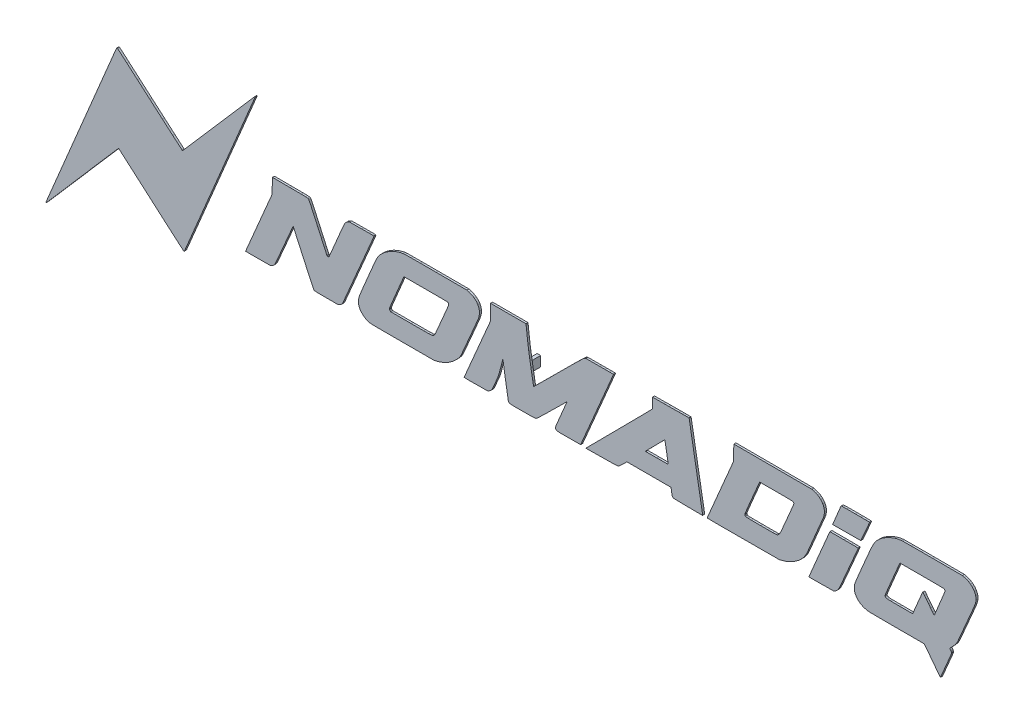
from build123d import *

# Parameters (mm, degrees)
Y_KSEKLIK_EKSTR_ZYON1_DEPTH   = 0.2
Y_KSEKLIK_EKSTR_ZYON1_2_DEPTH = 0.2
Y_KSEKLIK_EKSTR_ZYON1_3_DEPTH = 0.2
Y_KSEKLIK_EKSTR_ZYON1_4_DEPTH = 0.2
Y_KSEKLIK_EKSTR_ZYON1_5_DEPTH = 0.2
Y_KSEKLIK_EKSTR_ZYON1_6_DEPTH = 0.2
Y_KSEKLIK_EKSTR_ZYON1_7_DEPTH = 0.2
Y_KSEKLIK_EKSTR_ZYON1_8_DEPTH = 0.2
Y_KSEKLIK_EKSTR_ZYON1_9_DEPTH = 0.2
SKETCH4_W                     = 0.347706158
SKETCH4_H                     = 0.98459693
BOSS_EXTRUDE2_DEPTH           = 1
SCALE1_SCALE                  = 2.3


with BuildPart() as part:
    # Çizim1 → Yükseklik-Ekstrüzyon1 (new body)
    with BuildSketch(Plane.XY):
        with BuildLine():
            Line((-30.51702252, 5.640207004), (-31.881612062, 4.06777004))
            Line((-31.881612062, 4.06777004), (-33.036250842, 2.743929182))
            Line((-33.036250842, 2.743929182), (-34.080710724, 1.55031139))
            ThreePointArc((-34.080710724, 1.55031139), (-34.091671992, 1.542168784), (-34.10501822, 1.539282674))
            ThreePointArc((-34.10501822, 1.539282674), (-34.118726717, 1.541740246), (-34.130727781, 1.54880686))
            Line((-34.130727781, 1.54880686), (-35.069522655, 2.355004396))
            Line((-35.069522655, 2.355004396), (-36.109605746, 3.251459149))
            Line((-36.109605746, 3.251459149), (-37.338076284, 4.316207648))
            Line((-37.338076284, 4.316207648), (-38.566568336, 5.381941386))
            Line((-38.566568336, 5.381941386), (-39.606822395, 6.281527372))
            Line((-39.606822395, 6.281527372), (-40.544864829, 7.091037097))
            ThreePointArc((-40.544864829, 7.091037097), (-40.557629792, 7.100257414), (-40.571789719, 7.10714617))
            ThreePointArc((-40.571789719, 7.10714617), (-40.5829683, 7.1080489), (-40.592857954, 7.102760201))
            ThreePointArc((-40.592857954, 7.102760201), (-40.60694744, 7.08733319), (-40.619299402, 7.070482809))
            ThreePointArc((-40.619299402, 7.070482809), (-40.636141797, 7.042669784), (-40.651039165, 7.013768244))
            Line((-40.651039165, 7.013768244), (-40.690212238, 6.925912289))
            Line((-40.690212238, 6.925912289), (-42.278492498, 3.135697829))
            Line((-42.278492498, 3.135697829), (-44.770546021, -2.819218747))
            Line((-44.770546021, -2.819218747), (-47.603447582, -9.590605835))
            ThreePointArc((-47.603447582, -9.590605835), (-47.612762095, -9.614842221), (-47.620640209, -9.639582833))
            ThreePointArc((-47.620640209, -9.639582833), (-47.622682953, -9.648464643), (-47.623776393, -9.657512502))
            ThreePointArc((-47.623776393, -9.657512502), (-47.623612418, -9.665158958), (-47.622099978, -9.672656138))
            ThreePointArc((-47.622099978, -9.672656138), (-47.619722824, -9.678038864), (-47.616060206, -9.682644277))
            ThreePointArc((-47.616060206, -9.682644277), (-47.611784824, -9.685434425), (-47.606774081, -9.686412311))
            ThreePointArc((-47.606774081, -9.686412311), (-47.596603781, -9.684206995), (-47.588260373, -9.67798719))
            Line((-47.588260373, -9.67798719), (-46.540995922, -8.475870292))
            Line((-46.540995922, -8.475870292), (-45.384897882, -7.145566779))
            Line((-45.384897882, -7.145566779), (-44.016900278, -5.565418205))
            Line((-44.016900278, -5.565418205), (-42.649292697, -3.985259408))
            Line((-42.649292697, -3.985259408), (-41.494434005, -2.654966117))
            Line((-41.494434005, -2.654966117), (-40.447338079, -1.451149909))
            ThreePointArc((-40.447338079, -1.451149909), (-40.440685567, -1.446184753), (-40.432573306, -1.444424098))
            ThreePointArc((-40.432573306, -1.444424098), (-40.424232802, -1.445927767), (-40.416942521, -1.450249436))
            Line((-40.416942521, -1.450249436), (-39.470783162, -2.269237563))
            Line((-39.470783162, -2.269237563), (-38.425880059, -3.175657308))
            Line((-38.425880059, -3.175657308), (-37.188912139, -4.252299692))
            Line((-37.188912139, -4.252299692), (-35.600632388, -5.633848971))
            Line((-35.600632388, -5.633848971), (-34.660662613, -6.443124897))
            Line((-34.660662613, -6.443124897), (-33.971740802, -7.030480392))
            ThreePointArc((-33.971740802, -7.030480392), (-33.954050802, -7.036456708), (-33.937103258, -7.028618774))
            ThreePointArc((-33.937103258, -7.028618774), (-33.918071544, -7.004488567), (-33.903683781, -6.977332255))
            Line((-33.903683781, -6.977332255), (-30.415719601, 1.344084322))
            Line((-30.415719601, 1.344084322), (-26.926800707, 9.667966428))
            ThreePointArc((-26.926800707, 9.667966428), (-26.918578965, 9.694765841), (-26.915802041, 9.722660181))
            ThreePointArc((-26.915802041, 9.722660181), (-26.916283105, 9.726306898), (-26.91769339, 9.729704111))
            ThreePointArc((-26.91769339, 9.729704111), (-26.920050789, 9.732972259), (-26.923011854, 9.735705429))
            ThreePointArc((-26.923011854, 9.735705429), (-26.926812118, 9.738074074), (-26.930967674, 9.739742558))
            ThreePointArc((-26.930967674, 9.739742558), (-26.935605763, 9.740782255), (-26.94034612, 9.741131333))
            ThreePointArc((-26.94034612, 9.741131333), (-26.949504077, 9.739146935), (-26.957019216, 9.733549729))
            Line((-26.957019216, 9.733549729), (-28.001119252, 8.536484825))
            Line((-28.001119252, 8.536484825), (-29.153229053, 7.212664813))
            ThreePointArc((-29.153229053, 7.212664813), (-29.83537738, 6.426654115), (-30.51702252, 5.640207004))
        make_face()
    extrude(amount=Y_KSEKLIK_EKSTR_ZYON1_DEPTH)


with BuildPart() as body_2:
    # Çizim1 → Y_kseklik-Ekstr_zyon1 2 (new body)
    with BuildSketch(Plane.XY):
        with BuildLine():
            Line((34.002103981, 1.26593393), (33.401469652, -0.133194787))
            Line((33.401469652, -0.133194787), (33.068356265, -0.919046179))
            Line((33.068356265, -0.919046179), (32.780541835, -1.607236246))
            Line((32.780541835, -1.607236246), (32.536345399, -2.197879118))
            ThreePointArc((32.536345399, -2.197879118), (32.514730918, -2.255375588), (32.496752038, -2.314110499))
            ThreePointArc((32.496752038, -2.314110499), (32.475048302, -2.409792708), (32.46158888, -2.506978001))
            ThreePointArc((32.46158888, -2.506978001), (32.454335387, -2.617789021), (32.453635549, -2.728834983))
            ThreePointArc((32.453635549, -2.728834983), (32.45934273, -2.836087206), (32.471456413, -2.942805855))
            ThreePointArc((32.471456413, -2.942805855), (32.488615064, -3.027655366), (32.51524417, -3.110024958))
            ThreePointArc((32.51524417, -3.110024958), (32.598015349, -3.282399035), (32.706692791, -3.439730229))
            ThreePointArc((32.706692791, -3.439730229), (32.842536088, -3.584713762), (32.997270695, -3.709336501))
            ThreePointArc((32.997270695, -3.709336501), (33.178362317, -3.818649104), (33.37209352, -3.903570487))
            ThreePointArc((33.37209352, -3.903570487), (33.588460467, -3.96929215), (33.810587122, -4.011644735))
            ThreePointArc((33.810587122, -4.011644735), (33.899556978, -4.020972591), (33.988931573, -4.024823021))
            Line((33.988931573, -4.024823021), (34.653961876, -4.033038109))
            Line((34.653961876, -4.033038109), (35.528034198, -4.038897814))
            Line((35.528034198, -4.038897814), (36.700634893, -4.040997916))
            Line((36.700634893, -4.040997916), (39.381358713, -4.041881013))
            Line((39.381358713, -4.041881013), (40.168688525, -5.072515387))
            Line((40.168688525, -5.072515387), (40.471672307, -5.468355282))
            Line((40.471672307, -5.468355282), (40.729308349, -5.803224159))
            Line((40.729308349, -5.803224159), (40.960764599, -6.103025222))
            ThreePointArc((40.960764599, -6.103025222), (40.965728178, -6.108380079), (40.971569444, -6.112760857))
            ThreePointArc((40.971569444, -6.112760857), (40.980536493, -6.113867821), (40.987216734, -6.107784423))
            Line((40.987216734, -6.107784423), (41.525271591, -4.840033091))
            Line((41.525271591, -4.840033091), (42.037991789, -3.629832767))
            ThreePointArc((42.037991789, -3.629832767), (42.066806791, -3.554217315), (42.090091671, -3.476720121))
            ThreePointArc((42.090091671, -3.476720121), (42.091866692, -3.462041134), (42.089649173, -3.447422448))
            ThreePointArc((42.089649173, -3.447422448), (42.082221169, -3.425230658), (42.073172234, -3.403649008))
            ThreePointArc((42.073172234, -3.403649008), (42.059673501, -3.37676729), (42.044517758, -3.350783718))
            ThreePointArc((42.044517758, -3.350783718), (42.024882825, -3.320672342), (42.004149576, -3.291306409))
            Line((42.004149576, -3.291306409), (41.905031553, -3.15628061))
            Line((41.905031553, -3.15628061), (42.181877984, -2.866363537))
            ThreePointArc((42.181877984, -2.866363537), (42.242781131, -2.801216626), (42.302290033, -2.734793709))
            ThreePointArc((42.302290033, -2.734793709), (42.360432004, -2.667065558), (42.417129509, -2.598123669))
            ThreePointArc((42.417129509, -2.598123669), (42.467223313, -2.534442912), (42.515886055, -2.469662007))
            ThreePointArc((42.515886055, -2.469662007), (42.552003637, -2.417967566), (42.585675224, -2.364647597))
            ThreePointArc((42.585675224, -2.364647597), (42.664459092, -2.222753419), (42.733677151, -2.075955204))
            Line((42.733677151, -2.075955204), (43.510626934, -0.275958767))
            Line((43.510626934, -0.275958767), (44.264704846, 1.481742999))
            ThreePointArc((44.264704846, 1.481742999), (44.350931551, 1.69607884), (44.42787815, 1.913918501))
            ThreePointArc((44.42787815, 1.913918501), (44.474668475, 2.09316749), (44.498658632, 2.276862908))
            ThreePointArc((44.498658632, 2.276862908), (44.497009246, 2.450071361), (44.468931065, 2.620996797))
            ThreePointArc((44.468931065, 2.620996797), (44.4148335, 2.786765265), (44.33626524, 2.942434016))
            ThreePointArc((44.33626524, 2.942434016), (44.229301586, 3.097540689), (44.104447039, 3.238645774))
            ThreePointArc((44.104447039, 3.238645774), (44.029864114, 3.308427548), (43.950719161, 3.372989031))
            ThreePointArc((43.950719161, 3.372989031), (43.869333945, 3.430315276), (43.783968138, 3.481525928))
            ThreePointArc((43.783968138, 3.481525928), (43.689784399, 3.529322011), (43.592564606, 3.570593723))
            ThreePointArc((43.592564606, 3.570593723), (43.479323979, 3.611196818), (43.364327949, 3.646523356))
            Line((43.364327949, 3.646523356), (43.154477618, 3.705717052))
            Line((43.154477618, 3.705717052), (40.210910399, 3.709983164))
            Line((40.210910399, 3.709983164), (39.068321673, 3.709918807))
            Line((39.068321673, 3.709918807), (38.073061083, 3.706102713))
            Line((38.073061083, 3.706102713), (37.218259588, 3.700145881))
            ThreePointArc((37.218259588, 3.700145881), (37.142324383, 3.697538292), (37.066645419, 3.690781867))
            ThreePointArc((37.066645419, 3.690781867), (36.748045846, 3.637240098), (36.436400062, 3.552097196))
            ThreePointArc((36.436400062, 3.552097196), (36.105836544, 3.429413364), (35.785714306, 3.281611761))
            ThreePointArc((35.785714306, 3.281611761), (35.477485507, 3.109336623), (35.183436904, 2.913839475))
            ThreePointArc((35.183436904, 2.913839475), (34.930019667, 2.711059171), (34.69791904, 2.484190383))
            ThreePointArc((34.69791904, 2.484190383), (34.579233333, 2.345083525), (34.472303979, 2.19674901))
            ThreePointArc((34.472303979, 2.19674901), (34.366932693, 2.025944773), (34.272331054, 1.848948374))
            ThreePointArc((34.272331054, 1.848948374), (34.133445435, 1.559189511), (34.002103981, 1.26593393))
        make_face()
        with BuildLine():
            Line((41.408932632, 1.420979396), (40.91452838, 0.216535294))
            Line((40.91452838, 0.216535294), (40.420055007, -0.983846467))
            ThreePointArc((40.420055007, -0.983846467), (40.394632125, -1.032636029), (40.36097483, -1.076155344))
            ThreePointArc((40.36097483, -1.076155344), (40.353893848, -1.079121384), (40.347004716, -1.075733531))
            Line((40.347004716, -1.075733531), (40.188024724, -0.881888373))
            Line((40.188024724, -0.881888373), (40.008118257, -0.657479184))
            Line((40.008118257, -0.657479184), (39.797898801, -0.387093027))
            Line((39.797898801, -0.387093027), (39.587724356, -0.115332545))
            Line((39.587724356, -0.115332545), (39.407830653, 0.113502565))
            Line((39.407830653, 0.113502565), (39.246786084, 0.316042494))
            ThreePointArc((39.246786084, 0.316042494), (39.241550776, 0.320222793), (39.235019549, 0.321714909))
            ThreePointArc((39.235019549, 0.321714909), (39.228900127, 0.31988751), (39.224784801, 0.315003783))
            Line((39.224784801, 0.315003783), (39.077385422, -0.02410947))
            Line((39.077385422, -0.02410947), (38.914183191, -0.404157207))
            Line((38.914183191, -0.404157207), (38.723806616, -0.855559582))
            Line((38.723806616, -0.855559582), (38.230691459, -2.0328341))
            Line((38.230691459, -2.0328341), (36.946225763, -2.032592005))
            Line((36.946225763, -2.032592005), (36.026738721, -2.029967306))
            ThreePointArc((36.026738721, -2.029967306), (35.875481064, -2.025703145), (35.724571992, -2.014589469))
            ThreePointArc((35.724571992, -2.014589469), (35.649544634, -2.000929952), (35.577853042, -1.974929904))
            ThreePointArc((35.577853042, -1.974929904), (35.532477481, -1.941704962), (35.503641511, -1.893421163))
            ThreePointArc((35.503641511, -1.893421163), (35.495867211, -1.846409501), (35.504617437, -1.79956967))
            ThreePointArc((35.504617437, -1.79956967), (35.569300493, -1.630500251), (35.636155399, -1.462277817))
            Line((35.636155399, -1.462277817), (35.891488635, -0.845567436))
            Line((35.891488635, -0.845567436), (36.712056433, 1.091061579))
            Line((36.712056433, 1.091061579), (36.964632723, 1.686464948))
            Line((36.964632723, 1.686464948), (39.137080729, 1.686464948))
            Line((39.137080729, 1.686464948), (40.393285557, 1.685244626))
            Line((40.393285557, 1.685244626), (40.954397599, 1.679463593))
            Line((40.954397599, 1.679463593), (41.291963335, 1.67025887))
            ThreePointArc((41.291963335, 1.67025887), (41.332353577, 1.663192525), (41.369002218, 1.644802802))
            ThreePointArc((41.369002218, 1.644802802), (41.382729515, 1.633866704), (41.39500652, 1.621324294))
            ThreePointArc((41.39500652, 1.621324294), (41.405282108, 1.607693996), (41.413643556, 1.592812501))
            ThreePointArc((41.413643556, 1.592812501), (41.420269677, 1.576286022), (41.4247472, 1.559052862))
            ThreePointArc((41.4247472, 1.559052862), (41.427541535, 1.539642723), (41.428475816, 1.520054744))
            ThreePointArc((41.428475816, 1.520054744), (41.423543396, 1.469562516), (41.408932632, 1.420979396))
        make_face(mode=Mode.SUBTRACT)
    extrude(amount=Y_KSEKLIK_EKSTR_ZYON1_2_DEPTH)


with BuildPart() as body_3:
    # Çizim1 → Y_kseklik-Ekstr_zyon1 3 (new body)
    with BuildSketch(Plane.XY):
        with BuildLine():
            Line((-25.211224785, 2.950808873), (-25.227873842, 2.206347809))
            Line((-25.227873842, 2.206347809), (-26.529654081, -0.856672391))
            Line((-26.529654081, -0.856672391), (-27.029758258, -2.03354637))
            Line((-27.029758258, -2.03354637), (-27.453071642, -3.030058673))
            Line((-27.453071642, -3.030058673), (-27.833703249, -3.926302131))
            Line((-27.833703249, -3.926302131), (-27.845171441, -3.954171772))
            ThreePointArc((-27.845171441, -3.954171772), (-27.843842865, -3.967312442), (-27.83231739, -3.973762693))
            Line((-27.83231739, -3.973762693), (-27.614904594, -3.980356068))
            Line((-27.614904594, -3.980356068), (-27.278222587, -3.983689979))
            Line((-27.278222587, -3.983689979), (-26.631394189, -3.980931963))
            Line((-26.631394189, -3.980931963), (-25.403879775, -3.973212512))
            Line((-25.403879775, -3.973212512), (-25.250700632, -3.897992354))
            ThreePointArc((-25.250700632, -3.897992354), (-25.217687603, -3.880680333), (-25.185638296, -3.861643313))
            ThreePointArc((-25.185638296, -3.861643313), (-25.150757396, -3.838720203), (-25.11676827, -3.814494484))
            ThreePointArc((-25.11676827, -3.814494484), (-25.085085464, -3.790041552), (-25.054363066, -3.764392375))
            ThreePointArc((-25.054363066, -3.764392375), (-25.031252928, -3.742732785), (-25.009863314, -3.719372548))
            ThreePointArc((-25.009863314, -3.719372548), (-24.972694312, -3.668803102), (-24.942874437, -3.613580113))
            Line((-24.942874437, -3.613580113), (-24.735598075, -3.156531823))
            Line((-24.735598075, -3.156531823), (-24.453957617, -2.517394056))
            Line((-24.453957617, -2.517394056), (-24.039131152, -1.554161376))
            Line((-24.039131152, -1.554161376), (-23.699391394, -0.763531183))
            Line((-23.699391394, -0.763531183), (-23.410821404, -0.09780246))
            Line((-23.410821404, -0.09780246), (-23.149294716, 0.502140639))
            ThreePointArc((-23.149294716, 0.502140639), (-23.145665955, 0.506536134), (-23.140260373, 0.508343886))
            ThreePointArc((-23.140260373, 0.508343886), (-23.134825907, 0.506946553), (-23.131091279, 0.502758652))
            Line((-23.131091279, 0.502758652), (-22.835810828, -0.136341435))
            Line((-22.835810828, -0.136341435), (-22.51000193, -0.845183811))
            Line((-22.51000193, -0.845183811), (-22.126024477, -1.687301169))
            Line((-22.126024477, -1.687301169), (-21.620113231, -2.795615239))
            Line((-21.620113231, -2.795615239), (-21.322786771, -3.432082174))
            Line((-21.322786771, -3.432082174), (-21.11385138, -3.866353122))
            ThreePointArc((-21.11385138, -3.866353122), (-21.090737802, -3.90108777), (-21.059220458, -3.928426211))
            ThreePointArc((-21.059220458, -3.928426211), (-21.023863025, -3.945901297), (-20.985349445, -3.954400168))
            ThreePointArc((-20.985349445, -3.954400168), (-20.899319004, -3.961416502), (-20.813117741, -3.965867101))
            ThreePointArc((-20.813117741, -3.965867101), (-20.663197966, -3.970135482), (-20.513228263, -3.971937272))
            Line((-20.513228263, -3.971937272), (-19.839021238, -3.973214245))
            Line((-19.839021238, -3.973214245), (-18.687190754, -3.973214245))
            Line((-18.687190754, -3.973214245), (-18.517445616, -3.881186024))
            ThreePointArc((-18.517445616, -3.881186024), (-18.482303458, -3.861238906), (-18.44796421, -3.839939262))
            ThreePointArc((-18.44796421, -3.839939262), (-18.41333894, -3.816639004), (-18.379558411, -3.792130084))
            ThreePointArc((-18.379558411, -3.792130084), (-18.350067102, -3.769084074), (-18.32142443, -3.744991477))
            ThreePointArc((-18.32142443, -3.744991477), (-18.302919485, -3.727044384), (-18.286407888, -3.707247961))
            ThreePointArc((-18.286407888, -3.707247961), (-18.252048136, -3.65510512), (-18.224151108, -3.599237201))
            Line((-18.224151108, -3.599237201), (-16.713731049, -0.059918911))
            Line((-16.713731049, -0.059918911), (-15.222493404, 3.436166873))
            ThreePointArc((-15.222493404, 3.436166873), (-15.181801611, 3.540930402), (-15.148018691, 3.648121508))
            ThreePointArc((-15.148018691, 3.648121508), (-15.151158888, 3.667669436), (-15.168063421, 3.677975702))
            ThreePointArc((-15.168063421, 3.677975702), (-15.238167294, 3.684653858), (-15.308486134, 3.688450118))
            ThreePointArc((-15.308486134, 3.688450118), (-15.449595441, 3.691794732), (-15.590743095, 3.692397122))
            Line((-15.590743095, 3.692397122), (-16.348890724, 3.688267249))
            Line((-16.348890724, 3.688267249), (-17.563283304, 3.680066712))
            Line((-17.563283304, 3.680066712), (-17.695506951, 3.614506057))
            ThreePointArc((-17.695506951, 3.614506057), (-17.802334593, 3.550033382), (-17.89708974, 3.468852518))
            ThreePointArc((-17.89708974, 3.468852518), (-17.981687679, 3.369816632), (-18.051028752, 3.259559055))
            ThreePointArc((-18.051028752, 3.259559055), (-18.153011486, 3.057283908), (-18.246144045, 2.850784419))
            Line((-18.246144045, 2.850784419), (-18.805874805, 1.52590103))
            Line((-18.805874805, 1.52590103), (-19.098449411, 0.831007738))
            Line((-19.098449411, 0.831007738), (-19.349111607, 0.240390047))
            Line((-19.349111607, 0.240390047), (-19.573236314, -0.284773761))
            ThreePointArc((-19.573236314, -0.284773761), (-19.580906662, -0.299875069), (-19.590508016, -0.313828482))
            ThreePointArc((-19.590508016, -0.313828482), (-19.597563454, -0.321059745), (-19.605960459, -0.326677634))
            ThreePointArc((-19.605960459, -0.326677634), (-19.618425121, -0.33259943), (-19.631343535, -0.337452268))
            ThreePointArc((-19.631343535, -0.337452268), (-19.646310856, -0.34172327), (-19.661567254, -0.344806209))
            ThreePointArc((-19.661567254, -0.344806209), (-19.676924497, -0.346659137), (-19.692380729, -0.347278109))
            ThreePointArc((-19.692380729, -0.347278109), (-19.707631947, -0.346658834), (-19.722782748, -0.344805085))
            ThreePointArc((-19.722782748, -0.344805085), (-19.737441352, -0.341752399), (-19.751783682, -0.337452268))
            ThreePointArc((-19.751783682, -0.337452268), (-19.763833164, -0.332620652), (-19.775375089, -0.326677715))
            ThreePointArc((-19.775375089, -0.326677715), (-19.782823658, -0.321072837), (-19.788690101, -0.313828482))
            ThreePointArc((-19.788690101, -0.313828482), (-19.796630266, -0.300140237), (-19.803663618, -0.285964687))
            Line((-19.803663618, -0.285964687), (-20.059785204, 0.275398962))
            Line((-20.059785204, 0.275398962), (-20.346168765, 0.904480674))
            Line((-20.346168765, 0.904480674), (-20.682237627, 1.645080393))
            Line((-20.682237627, 1.645080393), (-21.125146527, 2.61767739))
            Line((-21.125146527, 2.61767739), (-21.387348416, 3.17841972))
            Line((-21.387348416, 3.17841972), (-21.570183946, 3.555457177))
            ThreePointArc((-21.570183946, 3.555457177), (-21.595062868, 3.593817601), (-21.628220762, 3.62529834))
            ThreePointArc((-21.628220762, 3.62529834), (-21.66998415, 3.648475335), (-21.716412578, 3.659689374))
            ThreePointArc((-21.716412578, 3.659689374), (-21.819651831, 3.668505866), (-21.923130902, 3.673812074))
            ThreePointArc((-21.923130902, 3.673812074), (-22.124276987, 3.679245381), (-22.325480701, 3.681762169))
            Line((-22.325480701, 3.681762169), (-23.448059115, 3.687666328))
            Line((-23.448059115, 3.687666328), (-25.194575701, 3.69526991))
            Line((-25.194575701, 3.69526991), (-25.211224785, 2.950808873))
        make_face()
    extrude(amount=Y_KSEKLIK_EKSTR_ZYON1_3_DEPTH)


with BuildPart() as body_4:
    # Çizim1 → Y_kseklik-Ekstr_zyon1 4 (new body)
    with BuildSketch(Plane.XY):
        with BuildLine():
            Line((-3.581342788, 2.937687788), (-3.581342788, 2.181933006))
            Line((-3.581342788, 2.181933006), (-4.877979733, -0.855499969))
            Line((-4.877979733, -0.855499969), (-5.376389886, -2.023485284))
            Line((-5.376389886, -2.023485284), (-5.798977842, -3.01476082))
            Line((-5.798977842, -3.01476082), (-6.177187776, -3.902529936))
            Line((-6.177187776, -3.902529936), (-6.192483113, -3.940843862))
            ThreePointArc((-6.192483113, -3.940843862), (-6.19070565, -3.959778104), (-6.174757915, -3.97013835))
            ThreePointArc((-6.174757915, -3.97013835), (-6.108607024, -3.976973725), (-6.042214703, -3.980810708))
            ThreePointArc((-6.042214703, -3.980810708), (-5.907118341, -3.984188986), (-5.771981293, -3.984835491))
            Line((-5.771981293, -3.984835491), (-5.049714422, -3.980989702))
            Line((-5.049714422, -3.980989702), (-3.889079328, -3.97321831))
            Line((-3.889079328, -3.97321831), (-3.755280818, -3.902422923))
            ThreePointArc((-3.755280818, -3.902422923), (-3.699406401, -3.871110537), (-3.645107405, -3.837139446))
            ThreePointArc((-3.645107405, -3.837139446), (-3.599819747, -3.804816928), (-3.557023912, -3.769260866))
            ThreePointArc((-3.557023912, -3.769260866), (-3.521239651, -3.734453546), (-3.488472326, -3.696792355))
            ThreePointArc((-3.488472326, -3.696792355), (-3.460868421, -3.65854243), (-3.437163193, -3.617761375))
            Line((-3.437163193, -3.617761375), (-3.409467918, -3.559967109))
            Line((-3.409467918, -3.559967109), (-3.318231303, -3.353000723))
            Line((-3.318231303, -3.353000723), (-3.210920349, -3.107231993))
            Line((-3.210920349, -3.107231993), (-3.091713476, -2.831363443))
            Line((-3.091713476, -2.831363443), (-2.901984085, -2.380888318))
            ThreePointArc((-2.901984085, -2.380888318), (-2.849132695, -2.246303299), (-2.800821012, -2.110022788))
            ThreePointArc((-2.800821012, -2.110022788), (-2.75541317, -1.967498293), (-2.714442326, -1.823635533))
            Line((-2.714442326, -1.823635533), (-2.576637461, -1.297248111))
            Line((-2.576637461, -1.297248111), (-2.364693476, -0.46769735))
            Line((-2.364693476, -0.46769735), (-2.342424293, -0.614875711))
            Line((-2.342424293, -0.614875711), (-2.175886465, -1.688377522))
            Line((-2.175886465, -1.688377522), (-2.001020215, -2.762609366))
            Line((-2.001020215, -2.762609366), (-1.827657004, -3.799629649))
            ThreePointArc((-1.827657004, -3.799629649), (-1.817395198, -3.837107712), (-1.799818726, -3.871762834))
            ThreePointArc((-1.799818726, -3.871762834), (-1.760431233, -3.913931089), (-1.708668946, -3.939430146))
            ThreePointArc((-1.708668946, -3.939430146), (-1.619855191, -3.95992499), (-1.52943784, -3.971441252))
            ThreePointArc((-1.52943784, -3.971441252), (-1.361958109, -3.981086279), (-1.194232166, -3.984325861))
            Line((-1.194232166, -3.984325861), (-0.370178516, -3.981533674))
            Line((-0.370178516, -3.981533674), (0.412079155, -3.974955416))
            ThreePointArc((0.412079155, -3.974955416), (0.547774653, -3.97215356), (0.683377872, -3.966418964))
            ThreePointArc((0.683377872, -3.966418964), (0.758299272, -3.959984356), (0.832642232, -3.948681938))
            ThreePointArc((0.832642232, -3.948681938), (0.888170338, -3.934183881), (0.941046882, -3.911876136))
            ThreePointArc((0.941046882, -3.911876136), (0.992500522, -3.880863438), (1.03902599, -3.842854948))
            Line((1.03902599, -3.842854948), (1.389463403, -3.51226382))
            Line((1.389463403, -3.51226382), (1.858226268, -3.059906204))
            Line((1.858226268, -3.059906204), (2.519872102, -2.409282638))
            Line((2.519872102, -2.409282638), (3.079518863, -1.857025568))
            Line((3.079518863, -1.857025568), (3.55159268, -1.39300024))
            Line((3.55159268, -1.39300024), (3.979388074, -0.973548682))
            ThreePointArc((3.979388074, -0.973548682), (3.981752203, -0.972565078), (3.984141133, -0.973486813))
            ThreePointArc((3.984141133, -0.973486813), (3.985534003, -0.975937947), (3.985273983, -0.978745176))
            Line((3.985273983, -0.978745176), (3.822937263, -1.366031839))
            Line((3.822937263, -1.366031839), (3.64253716, -1.794380169))
            Line((3.64253716, -1.794380169), (3.427125626, -2.30214522))
            Line((3.427125626, -2.30214522), (3.210345334, -2.815298578))
            Line((3.210345334, -2.815298578), (3.02532177, -3.261124231))
            Line((3.02532177, -3.261124231), (2.867303964, -3.647433203))
            ThreePointArc((2.867303964, -3.647433203), (2.856866474, -3.677566958), (2.849710985, -3.708644014))
            ThreePointArc((2.849710985, -3.708644014), (2.845973777, -3.745525407), (2.847549657, -3.782562152))
            ThreePointArc((2.847549657, -3.782562152), (2.854536895, -3.815872144), (2.867531368, -3.847328792))
            ThreePointArc((2.867531368, -3.847328792), (2.886447157, -3.876601018), (2.910271107, -3.902038976))
            ThreePointArc((2.910271107, -3.902038976), (2.941141306, -3.926286718), (2.97480815, -3.946472498))
            ThreePointArc((2.97480815, -3.946472498), (3.013686618, -3.961838711), (3.054855409, -3.969104141))
            ThreePointArc((3.054855409, -3.969104141), (3.149011305, -3.974975016), (3.243277696, -3.978669236))
            ThreePointArc((3.243277696, -3.978669236), (3.400427041, -3.981853612), (3.557606227, -3.982725472))
            Line((3.557606227, -3.982725472), (4.195740639, -3.980199115))
            Line((4.195740639, -3.980199115), (5.337959412, -3.973221282))
            Line((5.337959412, -3.973221282), (6.966141947, -0.151542952))
            Line((6.966141947, -0.151542952), (7.590452564, 1.31477638))
            Line((7.590452564, 1.31477638), (8.116045838, 2.551335091))
            Line((8.116045838, 2.551335091), (8.592238508, 3.672881405))
            ThreePointArc((8.592238508, 3.672881405), (8.593797679, 3.677901592), (8.594324454, 3.68313187))
            ThreePointArc((8.594324454, 3.68313187), (8.592776351, 3.686879381), (8.58903474, 3.688441694))
            Line((8.58903474, 3.688441694), (8.19146549, 3.68994968))
            Line((8.19146549, 3.68994968), (7.748767457, 3.690239006))
            Line((7.748767457, 3.690239006), (7.222889727, 3.688090951))
            Line((7.222889727, 3.688090951), (5.851455, 3.680053487))
            Line((5.851455, 3.680053487), (5.71765649, 3.615824288))
            ThreePointArc((5.71765649, 3.615824288), (5.650411941, 3.576670019), (5.590236811, 3.527336057))
            Line((5.590236811, 3.527336057), (5.118193952, 3.072857184))
            Line((5.118193952, 3.072857184), (4.407638634, 2.374674269))
            Line((4.407638634, 2.374674269), (3.128651934, 1.100755241))
            Line((3.128651934, 1.100755241), (2.187151745, 0.162855195))
            Line((2.187151745, 0.162855195), (1.394665044, -0.622263838))
            Line((1.394665044, -0.622263838), (0.681246947, -1.326491717))
            ThreePointArc((0.681246947, -1.326491717), (0.676262866, -1.327457611), (0.673449277, -1.32323177))
            ThreePointArc((0.673449277, -1.32323177), (0.67299094, -1.312469272), (0.67161927, -1.301784706))
            Line((0.67161927, -1.301784706), (0.598422887, -0.875986487))
            Line((0.598422887, -0.875986487), (0.515960564, -0.399306737))
            Line((0.515960564, -0.399306737), (0.418040258, 0.161592244))
            Line((0.418040258, 0.161592244), (0.291188032, 0.903058978))
            Line((0.291188032, 0.903058978), (0.196068557, 1.500503631))
            Line((0.196068557, 1.500503631), (0.121258385, 2.026138864))
            Line((0.121258385, 2.026138864), (0.057410592, 2.542769672))
            Line((0.057410592, 2.542769672), (0.015963453, 2.90471522))
            Line((0.015963453, 2.90471522), (-0.021497427, 3.228194365))
            Line((-0.021497427, 3.228194365), (-0.053395607, 3.500805617))
            Line((-0.053395607, 3.500805617), (-0.063455837, 3.579708124))
            Line((-0.063455837, 3.579708124), (-0.079101673, 3.693436857))
            Line((-0.079101673, 3.693436857), (-1.830222506, 3.693436857))
            Line((-1.830222506, 3.693436857), (-3.581342788, 3.693436857))
            Line((-3.581342788, 3.693436857), (-3.581342788, 2.937687788))
        make_face()
    extrude(amount=Y_KSEKLIK_EKSTR_ZYON1_4_DEPTH)

    # Sketch4 → Boss-Extrude2 (add)
    with BuildSketch(Plane(origin=(0, 0, 0), x_dir=(-1, 0, 0), z_dir=(0, 0, -1))):
        Rectangle(SKETCH4_W, SKETCH4_H)
    extrude(amount=BOSS_EXTRUDE2_DEPTH)


with BuildPart() as body_5:
    # Çizim1 → Y_kseklik-Ekstr_zyon1 5 (new body)
    with BuildSketch(Plane.XY):
        with BuildLine():
            Line((13.591695964, 3.673380528), (12.447718704, 3.666108284))
            Line((12.447718704, 3.666108284), (12.447718704, 3.155410932))
            Line((12.447718704, 3.155410932), (12.447718704, 2.64471358))
            Line((12.447718704, 2.64471358), (11.972733993, 2.155333862))
            Line((11.972733993, 2.155333862), (11.660281424, 1.836288425))
            Line((11.660281424, 1.836288425), (10.807976166, 0.974355882))
            Line((10.807976166, 0.974355882), (9.790523593, -0.052936313))
            Line((9.790523593, -0.052936313), (8.674600723, -1.17780265))
            Line((8.674600723, -1.17780265), (5.851452163, -4.021559472))
            Line((5.851452163, -4.021559472), (7.400482951, -4.003709787))
            Line((7.400482951, -4.003709787), (8.366956846, -3.991388577))
            ThreePointArc((8.366956846, -3.991388577), (8.555267482, -3.987403622), (8.743501416, -3.980713195))
            ThreePointArc((8.743501416, -3.980713195), (8.847707326, -3.974437186), (8.951630966, -3.964530774))
            ThreePointArc((8.951630966, -3.964530774), (9.012300957, -3.95295854), (9.070519291, -3.932333554))
            ThreePointArc((9.070519291, -3.932333554), (9.108676622, -3.912748433), (9.144323299, -3.888897366))
            ThreePointArc((9.144323299, -3.888897366), (9.198666305, -3.846504519), (9.251707467, -3.802493714))
            ThreePointArc((9.251707467, -3.802493714), (9.320097967, -3.74248067), (9.386959109, -3.680768325))
            Line((9.386959109, -3.680768325), (9.554919536, -3.517924085))
            Line((9.554919536, -3.517924085), (9.918314229, -3.157041112))
            Line((9.918314229, -3.157041112), (12.103479168, -3.157041112))
            Line((12.103479168, -3.157041112), (14.288644106, -3.157041112))
            Line((14.288644106, -3.157041112), (14.319315836, -3.3376691))
            Line((14.319315836, -3.3376691), (14.333123494, -3.419007141))
            Line((14.333123494, -3.419007141), (14.34933099, -3.514526888))
            Line((14.34933099, -3.514526888), (14.365325959, -3.608828211))
            Line((14.365325959, -3.608828211), (14.378424191, -3.686090321))
            ThreePointArc((14.378424191, -3.686090321), (14.38496437, -3.720539801), (14.39285899, -3.754704338))
            ThreePointArc((14.39285899, -3.754704338), (14.402111767, -3.788606903), (14.412686511, -3.822120671))
            ThreePointArc((14.412686511, -3.822120671), (14.423089822, -3.851055711), (14.434635942, -3.879554002))
            ThreePointArc((14.434635942, -3.879554002), (14.443710759, -3.897257414), (14.455129511, -3.913547754))
            Line((14.455129511, -3.913547754), (14.503398208, -3.973212023))
            Line((14.503398208, -3.973212023), (15.951798842, -3.996773806))
            Line((15.951798842, -3.996773806), (16.508385069, -4.004548196))
            Line((16.508385069, -4.004548196), (16.979872152, -4.008273949))
            Line((16.979872152, -4.008273949), (17.400693781, -4.009846857))
            ThreePointArc((17.400693781, -4.009846857), (17.409896429, -4.008040294), (17.417698554, -4.002836519))
            ThreePointArc((17.417698554, -4.002836519), (17.425884203, -3.989352189), (17.426924001, -3.973612086))
            Line((17.426924001, -3.973612086), (16.759811494, -0.174981033))
            Line((16.759811494, -0.174981033), (16.096046881, 3.603415005))
            ThreePointArc((16.096046881, 3.603415005), (16.086078489, 3.639653057), (16.069478939, 3.673372787))
            ThreePointArc((16.069478939, 3.673372787), (16.063459353, 3.679206411), (16.055383791, 3.681454052))
            Line((16.055383791, 3.681454052), (15.866662903, 3.685668583))
            Line((15.866662903, 3.685668583), (15.650595757, 3.688053729))
            Line((15.650595757, 3.688053729), (15.396396571, 3.687047671))
            Line((15.396396571, 3.687047671), (15.064684295, 3.684093534))
            Line((15.064684295, 3.684093534), (14.593717393, 3.680395048))
            Line((14.593717393, 3.680395048), (14.078109662, 3.67663341))
            ThreePointArc((14.078109662, 3.67663341), (13.834903081, 3.67496684), (13.591695964, 3.673380528))
        make_face()
        with BuildLine():
            Line((13.853552226, -0.354999481), (13.915636046, -0.717684158))
            Line((13.915636046, -0.717684158), (13.966243406, -1.026353628))
            Line((13.966243406, -1.026353628), (14.009776357, -1.300406533))
            ThreePointArc((14.009776357, -1.300406533), (14.009759396, -1.309078736), (14.007034075, -1.317311599))
            ThreePointArc((14.007034075, -1.317311599), (13.995308672, -1.329872078), (13.978770455, -1.334534486))
            Line((13.978770455, -1.334534486), (12.888343957, -1.337035454))
            Line((12.888343957, -1.337035454), (11.795917416, -1.338965257))
            ThreePointArc((11.795917416, -1.338965257), (11.783762948, -1.333946919), (11.778726154, -1.321800086))
            ThreePointArc((11.778726154, -1.321800086), (11.78239682, -1.303189638), (11.792858996, -1.287366699))
            Line((11.792858996, -1.287366699), (12.722639693, -0.345511936))
            Line((12.722639693, -0.345511936), (13.656683907, 0.60013871))
            ThreePointArc((13.656683907, 0.60013871), (13.666680675, 0.604332847), (13.676702679, 0.600199374))
            ThreePointArc((13.676702679, 0.600199374), (13.68091864, 0.594476389), (13.683248558, 0.587760858))
            Line((13.683248558, 0.587760858), (13.733996809, 0.314265162))
            Line((13.733996809, 0.314265162), (13.78978383, 0.007183104))
            ThreePointArc((13.78978383, 0.007183104), (13.821854914, -0.173875284), (13.853552226, -0.354999481))
        make_face(mode=Mode.SUBTRACT)
    extrude(amount=Y_KSEKLIK_EKSTR_ZYON1_5_DEPTH)


with BuildPart() as body_6:
    # Çizim1 → Y_kseklik-Ekstr_zyon1 6 (new body)
    with BuildSketch(Plane.XY):
        with BuildLine():
            Line((31.112719083, 3.61013533), (31.010052357, 3.365928946))
            Line((31.010052357, 3.365928946), (30.89190953, 3.083300172))
            Line((30.89190953, 3.083300172), (30.756421065, 2.756853028))
            Line((30.756421065, 2.756853028), (30.618808468, 2.424701518))
            Line((30.618808468, 2.424701518), (30.493966831, 2.124125146))
            Line((30.493966831, 2.124125146), (30.388978057, 1.8719529))
            Line((30.388978057, 1.8719529), (30.352849088, 1.786575589))
            Line((30.352849088, 1.786575589), (30.29813762, 1.659228763))
            Line((30.29813762, 1.659228763), (31.693687253, 1.66615693))
            Line((31.693687253, 1.66615693), (33.089236887, 1.673085097))
            Line((33.089236887, 1.673085097), (33.525372371, 2.663194071))
            Line((33.525372371, 2.663194071), (33.69261818, 3.044235877))
            Line((33.69261818, 3.044235877), (33.833541594, 3.368354017))
            Line((33.833541594, 3.368354017), (33.958614301, 3.657906703))
            ThreePointArc((33.958614301, 3.657906703), (33.961055271, 3.665476821), (33.962013505, 3.673372821))
            ThreePointArc((33.962013505, 3.673372821), (33.95977608, 3.679139125), (33.954103599, 3.681604746))
            Line((33.954103599, 3.681604746), (33.549962424, 3.687547091))
            Line((33.549962424, 3.687547091), (33.096884008, 3.692000414))
            Line((33.096884008, 3.692000414), (32.558576316, 3.693442575))
            Line((32.558576316, 3.693442575), (31.697002862, 3.692336462))
            ThreePointArc((31.697002862, 3.692336462), (31.529332623, 3.690639931), (31.361707114, 3.686411918))
            ThreePointArc((31.361707114, 3.686411918), (31.267942718, 3.682232818), (31.174302699, 3.675847407))
            ThreePointArc((31.174302699, 3.675847407), (31.148374476, 3.666927147), (31.129957551, 3.646613096))
            ThreePointArc((31.129957551, 3.646613096), (31.120941637, 3.628561674), (31.112719083, 3.61013533))
        make_face()
    extrude(amount=Y_KSEKLIK_EKSTR_ZYON1_6_DEPTH)


with BuildPart() as body_7:
    # Çizim1 → Y_kseklik-Ekstr_zyon1 7 (new body)
    with BuildSketch(Plane.XY):
        with BuildLine():
            Line((-14.928138507, 1.758356615), (-15.172333555, 1.188149123))
            Line((-15.172333555, 1.188149123), (-15.455645504, 0.523192953))
            Line((-15.455645504, 0.523192953), (-15.778903293, -0.240233595))
            Line((-15.778903293, -0.240233595), (-16.38384481, -1.682932245))
            ThreePointArc((-16.38384481, -1.682932245), (-16.492546721, -1.956725141), (-16.592156754, -2.233955184))
            ThreePointArc((-16.592156754, -2.233955184), (-16.639880175, -2.398482509), (-16.672244795, -2.566706458))
            ThreePointArc((-16.672244795, -2.566706458), (-16.682347813, -2.712050518), (-16.670749998, -2.857282944))
            ThreePointArc((-16.670749998, -2.857282944), (-16.651609527, -2.957214032), (-16.625523774, -3.055560936))
            ThreePointArc((-16.625523774, -3.055560936), (-16.594736036, -3.142100568), (-16.555875522, -3.225328286))
            ThreePointArc((-16.555875522, -3.225328286), (-16.508129664, -3.30679487), (-16.453136516, -3.383555701))
            ThreePointArc((-16.453136516, -3.383555701), (-16.382832864, -3.467556124), (-16.30770931, -3.54727517))
            ThreePointArc((-16.30770931, -3.54727517), (-16.230933159, -3.619602234), (-16.149948825, -3.687184178))
            ThreePointArc((-16.149948825, -3.687184178), (-16.070215782, -3.745140417), (-15.986434442, -3.797072787))
            ThreePointArc((-15.986434442, -3.797072787), (-15.897666117, -3.843510204), (-15.805780202, -3.883425462))
            ThreePointArc((-15.805780202, -3.883425462), (-15.702052685, -3.920894313), (-15.596448981, -3.952693218))
            ThreePointArc((-15.596448981, -3.952693218), (-15.504170827, -3.972241493), (-15.410274322, -3.981232547))
            ThreePointArc((-15.410274322, -3.981232547), (-15.192441959, -3.988355926), (-14.974538656, -3.992809116))
            Line((-14.974538656, -3.992809116), (-14.201239142, -3.998810487))
            Line((-14.201239142, -3.998810487), (-12.291625786, -3.999971725))
            Line((-12.291625786, -3.999971725), (-9.160740653, -3.999971725))
            Line((-9.160740653, -3.999971725), (-8.872671765, -3.924864653))
            ThreePointArc((-8.872671765, -3.924864653), (-8.606556175, -3.846491173), (-8.345876713, -3.751590552))
            ThreePointArc((-8.345876713, -3.751590552), (-8.098720424, -3.64284155), (-7.859526301, -3.517546907))
            ThreePointArc((-7.859526301, -3.517546907), (-7.631219554, -3.377311845), (-7.413061305, -3.221758568))
            ThreePointArc((-7.413061305, -3.221758568), (-7.20326046, -3.0497456), (-7.005274729, -2.864255693))
            ThreePointArc((-7.005274729, -2.864255693), (-6.943134452, -2.80073685), (-6.882342531, -2.735926358))
            ThreePointArc((-6.882342531, -2.735926358), (-6.823660322, -2.670618883), (-6.766414658, -2.604048606))
            ThreePointArc((-6.766414658, -2.604048606), (-6.716231693, -2.542970211), (-6.667473336, -2.480748649))
            ThreePointArc((-6.667473336, -2.480748649), (-6.631508611, -2.431272847), (-6.598016442, -2.380090906))
            ThreePointArc((-6.598016442, -2.380090906), (-6.518184204, -2.239941857), (-6.448961621, -2.094260093))
            Line((-6.448961621, -2.094260093), (-5.65771842, -0.256093023))
            Line((-5.65771842, -0.256093023), (-4.881822359, 1.557288458))
            ThreePointArc((-4.881822359, 1.557288458), (-4.808140235, 1.744589786), (-4.745168429, 1.935758283))
            ThreePointArc((-4.745168429, 1.935758283), (-4.693256619, 2.198883786), (-4.692043383, 2.467078481))
            ThreePointArc((-4.692043383, 2.467078481), (-4.742993679, 2.71676195), (-4.847523627, 2.949165171))
            ThreePointArc((-4.847523627, 2.949165171), (-5.004851933, 3.161040399), (-5.203017731, 3.335320703))
            ThreePointArc((-5.203017731, 3.335320703), (-5.452496019, 3.483692207), (-5.72231033, 3.590714431))
            Line((-5.72231033, 3.590714431), (-5.922816492, 3.652333767))
            Line((-5.922816492, 3.652333767), (-8.98680237, 3.657145349))
            Line((-8.98680237, 3.657145349), (-10.545140075, 3.658095211))
            Line((-10.545140075, 3.658095211), (-11.45529906, 3.65382934))
            Line((-11.45529906, 3.65382934), (-12.05787328, 3.645814408))
            ThreePointArc((-12.05787328, 3.645814408), (-12.155023147, 3.640420694), (-12.251486013, 3.62768867))
            ThreePointArc((-12.251486013, 3.62768867), (-12.661701206, 3.534132793), (-13.059134627, 3.396017327))
            ThreePointArc((-13.059134627, 3.396017327), (-13.450918462, 3.211506012), (-13.822074122, 2.988386144))
            ThreePointArc((-13.822074122, 2.988386144), (-14.15309134, 2.73962069), (-14.456130543, 2.457443632))
            ThreePointArc((-14.456130543, 2.457443632), (-14.690840876, 2.174909448), (-14.880577923, 1.860402917))
            ThreePointArc((-14.880577923, 1.860402917), (-14.905162159, 1.809754459), (-14.928138507, 1.758356615))
        make_face()
        with BuildLine():
            Line((-7.756110428, 1.399852812), (-8.414347746, -0.147091745))
            Line((-8.414347746, -0.147091745), (-9.070799602, -1.683865385))
            ThreePointArc((-9.070799602, -1.683865385), (-9.107801561, -1.753471267), (-9.155939394, -1.815896203))
            ThreePointArc((-9.155939394, -1.815896203), (-9.170350949, -1.830458472), (-9.185857758, -1.843848451))
            ThreePointArc((-9.185857758, -1.843848451), (-9.206925987, -1.860026288), (-9.228571005, -1.875423882))
            ThreePointArc((-9.228571005, -1.875423882), (-9.252038516, -1.890869075), (-9.276045767, -1.905461193))
            ThreePointArc((-9.276045767, -1.905461193), (-9.29838999, -1.917791122), (-9.321298859, -1.92903724))
            ThreePointArc((-9.321298859, -1.92903724), (-9.378817191, -1.949454485), (-9.439086905, -1.95908694))
            ThreePointArc((-9.439086905, -1.95908694), (-9.573890023, -1.966675474), (-9.708826922, -1.971312244))
            Line((-9.708826922, -1.971312244), (-10.196794664, -1.977531707))
            Line((-10.196794664, -1.977531707), (-11.456601454, -1.97902653))
            Line((-11.456601454, -1.97902653), (-13.484865216, -1.979614227))
            Line((-13.484865216, -1.979614227), (-13.553538318, -1.910941125))
            ThreePointArc((-13.553538318, -1.910941125), (-13.570281579, -1.893050252), (-13.585803748, -1.874090232))
            ThreePointArc((-13.585803748, -1.874090232), (-13.59611997, -1.858375217), (-13.604074122, -1.841342378))
            ThreePointArc((-13.604074122, -1.841342378), (-13.608834493, -1.824900555), (-13.610810342, -1.807897888))
            ThreePointArc((-13.610810342, -1.807897888), (-13.610328345, -1.788530215), (-13.607626981, -1.769345801))
            ThreePointArc((-13.607626981, -1.769345801), (-13.597557852, -1.729374762), (-13.583596637, -1.690591314))
            Line((-13.583596637, -1.690591314), (-13.060438526, -0.435457154))
            Line((-13.060438526, -0.435457154), (-12.577804341, 0.716807291))
            Line((-12.577804341, 0.716807291), (-12.224815962, 1.546527629))
            Line((-12.224815962, 1.546527629), (-12.164616533, 1.686464948))
            Line((-12.164616533, 1.686464948), (-10.006330163, 1.686464948))
            Line((-10.006330163, 1.686464948), (-8.75852154, 1.68524385))
            Line((-8.75852154, 1.68524385), (-8.200897759, 1.67946156))
            Line((-8.200897759, 1.67946156), (-7.865541337, 1.670245478))
            ThreePointArc((-7.865541337, 1.670245478), (-7.825186705, 1.663178697), (-7.788570341, 1.644802691))
            ThreePointArc((-7.788570341, 1.644802691), (-7.775640709, 1.634507681), (-7.764070148, 1.622705787))
            ThreePointArc((-7.764070148, 1.622705787), (-7.753813319, 1.60937442), (-7.745176674, 1.594940562))
            ThreePointArc((-7.745176674, 1.594940562), (-7.738293899, 1.579631406), (-7.733242623, 1.563624299))
            ThreePointArc((-7.733242623, 1.563624299), (-7.730220802, 1.547476942), (-7.729227831, 1.531079304))
            ThreePointArc((-7.729227831, 1.531079304), (-7.736077893, 1.464115801), (-7.756110428, 1.399852812))
        make_face(mode=Mode.SUBTRACT)
    extrude(amount=Y_KSEKLIK_EKSTR_ZYON1_7_DEPTH)


with BuildPart() as body_8:
    # Çizim1 → Y_kseklik-Ekstr_zyon1 8 (new body)
    with BuildSketch(Plane.XY):
        with BuildLine():
            Line((20.49534976, 2.90866714), (20.47999119, 2.149435978))
            Line((20.47999119, 2.149435978), (19.189761963, -0.885128196))
            Line((19.189761963, -0.885128196), (18.694149456, -2.051989925))
            Line((18.694149456, -2.051989925), (18.274692251, -3.042238664))
            Line((18.274692251, -3.042238664), (17.899473758, -3.929682195))
            ThreePointArc((17.899473758, -3.929682195), (17.892343883, -3.94821775), (17.886442291, -3.967180164))
            ThreePointArc((17.886442291, -3.967180164), (17.890604776, -3.989176004), (17.910545798, -3.999349444))
            Line((17.910545798, -3.999349444), (18.383931853, -4.006805537))
            Line((18.383931853, -4.006805537), (19.194480202, -4.010767364))
            Line((19.194480202, -4.010767364), (21.455755166, -4.006787073))
            Line((21.455755166, -4.006787073), (25.03815849, -3.998905859))
            Line((25.03815849, -3.998905859), (25.31085243, -3.926648134))
            ThreePointArc((25.31085243, -3.926648134), (25.692255155, -3.806410605), (26.060885667, -3.651373033))
            ThreePointArc((26.060885667, -3.651373033), (26.413020947, -3.463072236), (26.74611769, -3.242838256))
            ThreePointArc((26.74611769, -3.242838256), (27.039204686, -3.005877799), (27.307624036, -2.741300214))
            ThreePointArc((27.307624036, -2.741300214), (27.51750102, -2.478750878), (27.689209278, -2.189792791))
            ThreePointArc((27.689209278, -2.189792791), (27.772341227, -2.017796564), (27.849633639, -1.843098235))
            Line((27.849633639, -1.843098235), (28.584835976, -0.102735674))
            Line((28.584835976, -0.102735674), (29.340038385, 1.690581838))
            ThreePointArc((29.340038385, 1.690581838), (29.38429279, 1.804417968), (29.422253287, 1.920504649))
            ThreePointArc((29.422253287, 1.920504649), (29.463848454, 2.098467303), (29.484179787, 2.280091918))
            ThreePointArc((29.484179787, 2.280091918), (29.480921136, 2.451548286), (29.453289618, 2.620794865))
            ThreePointArc((29.453289618, 2.620794865), (29.402439612, 2.781670192), (29.328758375, 2.933451842))
            ThreePointArc((29.328758375, 2.933451842), (29.231282864, 3.079050099), (29.115722487, 3.210754793))
            ThreePointArc((29.115722487, 3.210754793), (29.048679297, 3.273458373), (28.977587434, 3.33153139))
            ThreePointArc((28.977587434, 3.33153139), (28.90253895, 3.384911488), (28.824115672, 3.433197091))
            ThreePointArc((28.824115672, 3.433197091), (28.738384773, 3.478645287), (28.649982852, 3.518650613))
            ThreePointArc((28.649982852, 3.518650613), (28.550762754, 3.557135466), (28.449830089, 3.590874296))
            Line((28.449830089, 3.590874296), (28.249322733, 3.652653915))
            Line((28.249322733, 3.652653915), (24.380015558, 3.660276095))
            Line((24.380015558, 3.660276095), (20.510708357, 3.667898302))
            Line((20.510708357, 3.667898302), (20.49534976, 2.90866714))
        make_face()
        with BuildLine():
            Line((26.463296291, 1.504551643), (26.263918737, 1.02633146))
            Line((26.263918737, 1.02633146), (26.037619858, 0.488451094))
            Line((26.037619858, 0.488451094), (25.768921623, -0.142106657))
            Line((25.768921623, -0.142106657), (25.26751465, -1.304753545))
            ThreePointArc((25.26751465, -1.304753545), (25.176841101, -1.502596721), (25.07833105, -1.696656981))
            ThreePointArc((25.07833105, -1.696656981), (25.016861383, -1.79579676), (24.94300539, -1.886088001))
            ThreePointArc((24.94300539, -1.886088001), (24.87313194, -1.942670666), (24.790397861, -1.977869658))
            ThreePointArc((24.790397861, -1.977869658), (24.740601508, -1.988074812), (24.689934196, -1.99215469))
            Line((24.689934196, -1.99215469), (24.350009923, -1.998768705))
            Line((24.350009923, -1.998768705), (23.878789526, -2.002066277))
            Line((23.878789526, -2.002066277), (23.195915542, -2.000343032))
            Line((23.195915542, -2.000343032), (22.261918613, -1.994623413))
            ThreePointArc((22.261918613, -1.994623413), (22.088467164, -1.992032794), (21.915075545, -1.986792294))
            ThreePointArc((21.915075545, -1.986792294), (21.82089395, -1.98171954), (21.72692214, -1.97364461))
            ThreePointArc((21.72692214, -1.97364461), (21.688858078, -1.963511332), (21.655849629, -1.942017184))
            ThreePointArc((21.655849629, -1.942017184), (21.644418187, -1.930486336), (21.63429683, -1.91779002))
            ThreePointArc((21.63429683, -1.91779002), (21.62456121, -1.902867309), (21.616078718, -1.887198329))
            ThreePointArc((21.616078718, -1.887198329), (21.609182399, -1.871474784), (21.603626679, -1.855229075))
            ThreePointArc((21.603626679, -1.855229075), (21.600564594, -1.841254008), (21.599536833, -1.82698437))
            ThreePointArc((21.599536833, -1.82698437), (21.601939658, -1.802324248), (21.609057756, -1.778591826))
            Line((21.609057756, -1.778591826), (21.803080764, -1.304592687))
            Line((21.803080764, -1.304592687), (22.026834822, -0.765868802))
            Line((22.026834822, -0.765868802), (22.292452481, -0.138580632))
            Line((22.292452481, -0.138580632), (22.561021306, 0.491207135))
            Line((22.561021306, 0.491207135), (22.794047306, 1.038092488))
            Line((22.794047306, 1.038092488), (22.995219574, 1.510533073))
            Line((22.995219574, 1.510533073), (23.026978818, 1.586116066))
            Line((23.026978818, 1.586116066), (23.068589486, 1.686464948))
            Line((23.068589486, 1.686464948), (24.715676598, 1.686464948))
            Line((24.715676598, 1.686464948), (25.784346919, 1.68545022))
            ThreePointArc((25.784346919, 1.68545022), (25.96750737, 1.683748628), (26.150622668, 1.679340258))
            ThreePointArc((26.150622668, 1.679340258), (26.247882003, 1.67464866), (26.344929781, 1.666703972))
            ThreePointArc((26.344929781, 1.666703972), (26.383534209, 1.656012979), (26.416283142, 1.632945544))
            ThreePointArc((26.416283142, 1.632945544), (26.426941329, 1.621504976), (26.43676376, 1.609339313))
            ThreePointArc((26.43676376, 1.609339313), (26.445871369, 1.596312486), (26.454081221, 1.582702009))
            ThreePointArc((26.454081221, 1.582702009), (26.460542081, 1.570093867), (26.46609135, 1.557058776))
            ThreePointArc((26.46609135, 1.557058776), (26.468866309, 1.547232361), (26.469802472, 1.537064646))
            ThreePointArc((26.469802472, 1.537064646), (26.468159965, 1.52048585), (26.463296291, 1.504551643))
        make_face(mode=Mode.SUBTRACT)
    extrude(amount=Y_KSEKLIK_EKSTR_ZYON1_8_DEPTH)


with BuildPart() as body_9:
    # Çizim1 → Y_kseklik-Ekstr_zyon1 9 (new body)
    with BuildSketch(Plane.XY):
        with BuildLine():
            Line((30.003688951, 0.850224261), (29.98414982, 0.802572002))
            Line((29.98414982, 0.802572002), (29.694368686, 0.119893444))
            Line((29.694368686, 0.119893444), (29.367580945, -0.649490751))
            Line((29.367580945, -0.649490751), (28.984146286, -1.551458993))
            Line((28.984146286, -1.551458993), (28.601453299, -2.45356023))
            Line((28.601453299, -2.45356023), (28.276958837, -3.223325188))
            Line((28.276958837, -3.223325188), (27.990069036, -3.90695674))
            ThreePointArc((27.990069036, -3.90695674), (27.981407233, -3.9305782), (27.9749355, -3.954891096))
            Line((27.9749355, -3.954891096), (27.961438081, -4.01684939))
            Line((27.961438081, -4.01684939), (29.16238862, -4.008410557))
            Line((29.16238862, -4.008410557), (30.363339186, -3.999971725))
            Line((30.363339186, -3.999971725), (30.527272171, -3.924215891))
            ThreePointArc((30.527272171, -3.924215891), (30.639796798, -3.858691471), (30.73801922, -3.773206986))
            ThreePointArc((30.73801922, -3.773206986), (30.830185926, -3.661769282), (30.906105793, -3.538687045))
            ThreePointArc((30.906105793, -3.538687045), (31.026718097, -3.298046505), (31.138143985, -3.053016977))
            Line((31.138143985, -3.053016977), (31.850886745, -1.4035809))
            Line((31.850886745, -1.4035809), (32.222429259, -0.539636322))
            Line((32.222429259, -0.539636322), (32.537466975, 0.19326728))
            Line((32.537466975, 0.19326728), (32.819709714, 0.85008834))
            Line((32.819709714, 0.85008834), (32.830893423, 0.876980021))
            ThreePointArc((32.830893423, 0.876980021), (32.829634772, 0.889708888), (32.818470169, 0.895950672))
            Line((32.818470169, 0.895950672), (32.555927533, 0.903648695))
            Line((32.555927533, 0.903648695), (32.162998452, 0.909086935))
            Line((32.162998452, 0.909086935), (31.43592793, 0.910433591))
            Line((31.43592793, 0.910433591), (30.027518252, 0.910433591))
            Line((30.027518252, 0.910433591), (30.003688951, 0.850224261))
        make_face()
    extrude(amount=Y_KSEKLIK_EKSTR_ZYON1_9_DEPTH)


with BuildPart() as body_5_1:
    # Scale1: scaled about (0, 0, 0)
    add(body_5.part.scale(SCALE1_SCALE))


with BuildPart() as body_3_1:
    # Scale1: scaled about (0, 0, 0)
    add(body_3.part.scale(SCALE1_SCALE))


with BuildPart() as part_1:
    # Scale1: scaled about (0, 0, 0)
    add(part.part.scale(SCALE1_SCALE))


with BuildPart() as body_7_1:
    # Scale1: scaled about (0, 0, 0)
    add(body_7.part.scale(SCALE1_SCALE))


with BuildPart() as body_4_1:
    # Scale1: scaled about (0, 0, 0)
    add(body_4.part.scale(SCALE1_SCALE))


with BuildPart() as body_6_1:
    # Scale1: scaled about (0, 0, 0)
    add(body_6.part.scale(SCALE1_SCALE))


with BuildPart() as body_9_1:
    # Scale1: scaled about (0, 0, 0)
    add(body_9.part.scale(SCALE1_SCALE))


with BuildPart() as body_2_1:
    # Scale1: scaled about (0, 0, 0)
    add(body_2.part.scale(SCALE1_SCALE))


with BuildPart() as body_8_1:
    # Scale1: scaled about (0, 0, 0)
    add(body_8.part.scale(SCALE1_SCALE))


solid = Compound([body_5_1.part, body_3_1.part, part_1.part, body_7_1.part, body_4_1.part, body_6_1.part, body_9_1.part, body_2_1.part, body_8_1.part])
